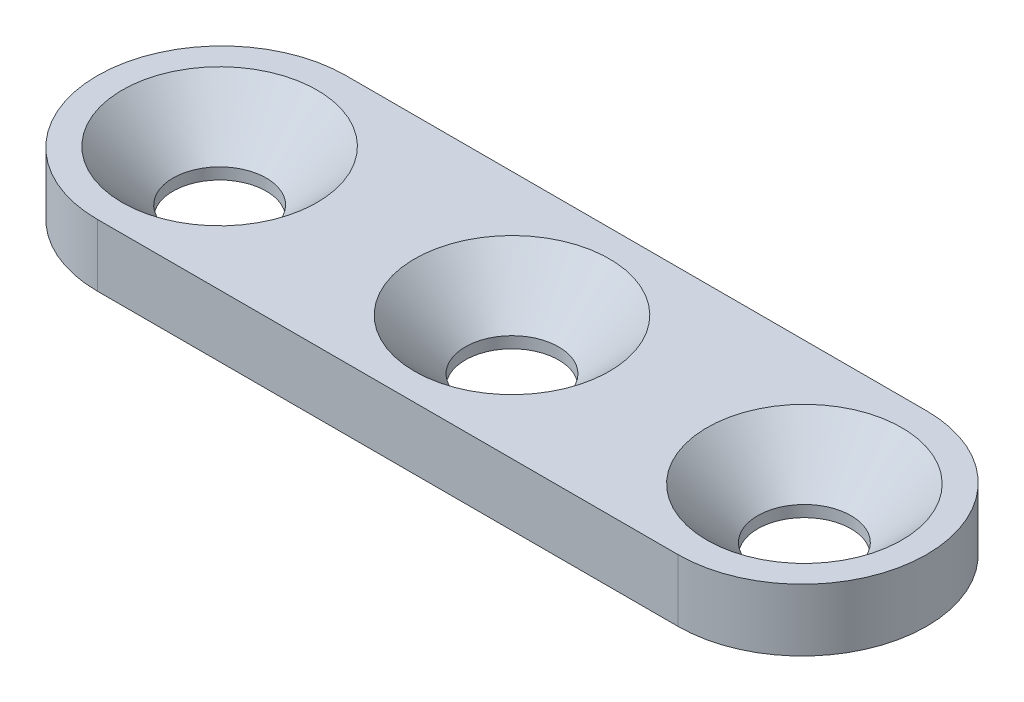
from build123d import *

# Parameters (mm, degrees)
BOSS_EXTRUDE1_DEPTH                            = 3
CSK_FOR_M4_FLAT_HEAD_MACHINE_SCREW7_AT_2_COUNT = 2
CSK_FOR_M4_FLAT_HEAD_MACHINE_SCREW7_AT_2_PITCH = 14.1
CSK_FOR_M4_FLAT_HEAD_MACHINE_SCREW7_AT_3_COUNT = 2
CSK_FOR_M4_FLAT_HEAD_MACHINE_SCREW7_AT_3_PITCH = 14.1


with BuildPart() as part:
    # Sketch2 → Boss-Extrude1 (new body)
    with BuildSketch(Plane(origin=(0, 0, 0), x_dir=(1, 0, 0), z_dir=(0, 1, 0))):
        with BuildLine():
            Line((14, -6), (-14, -6))
            ThreePointArc((-14, -6), (-20, 0), (-14, 6))
            Line((-14, 6), (14, 6))
            ThreePointArc((14, 6), (20, 0), (14, -6))
        make_face()
    extrude(amount=-BOSS_EXTRUDE1_DEPTH)

    # Sketch22 → CSK for M4 Flat Head Machine Screw7 (revolve, cut)
    with BuildSketch(Plane(origin=(0, 0, 0), x_dir=(0, 0, 1), z_dir=(1, 0, 0))):
        Polygon((0, 0), (0, 3), (2.25, 3), (2.25, 2.45), (4.7, 0), align=None)
    csk_for_m4_flat_head_machine_screw7 = revolve(axis=Axis((0, 6.35, 0), (0, -1, 0)), mode=Mode.SUBTRACT)

    # CSK for M4 Flat Head Machine Screw7 at 2: CSK for M4 Flat Head Machine Screw7 ×2
    with Locations(*[(-i * CSK_FOR_M4_FLAT_HEAD_MACHINE_SCREW7_AT_2_PITCH, 0, 0) for i in range(1, CSK_FOR_M4_FLAT_HEAD_MACHINE_SCREW7_AT_2_COUNT)]):
        add(csk_for_m4_flat_head_machine_screw7, mode=Mode.SUBTRACT)

    # CSK for M4 Flat Head Machine Screw7 at 3: CSK for M4 Flat Head Machine Screw7 ×2
    with Locations(*[(i * CSK_FOR_M4_FLAT_HEAD_MACHINE_SCREW7_AT_3_PITCH, 0, 0) for i in range(1, CSK_FOR_M4_FLAT_HEAD_MACHINE_SCREW7_AT_3_COUNT)]):
        add(csk_for_m4_flat_head_machine_screw7, mode=Mode.SUBTRACT)


solid = part.part
